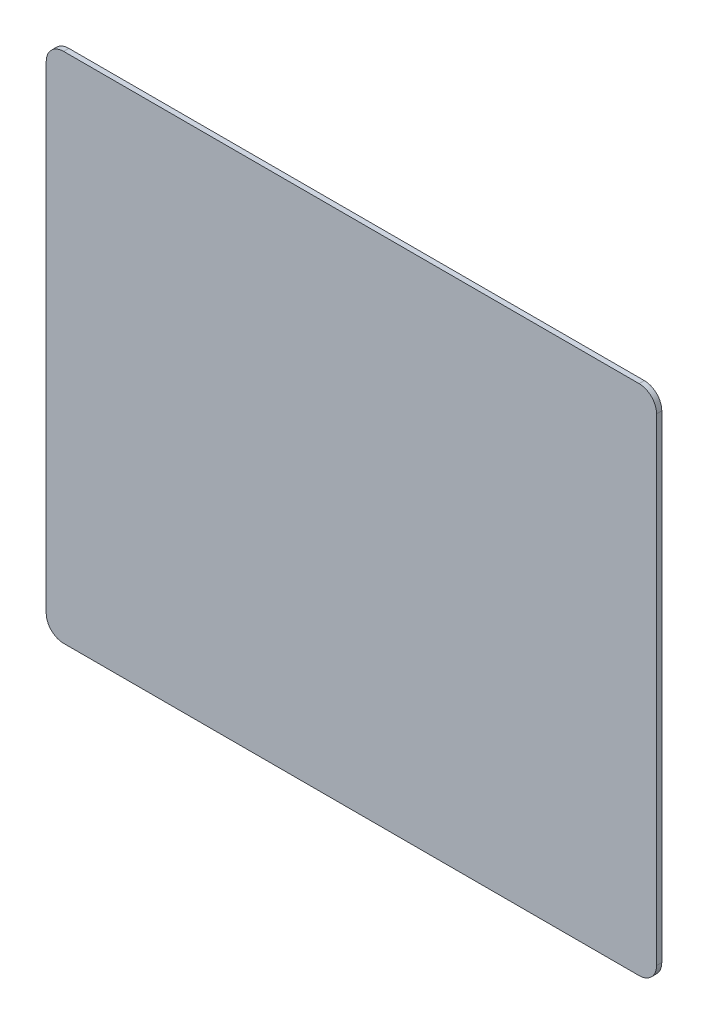
from build123d import *

# Parameters (mm, degrees)
SKETCH1_W           = 700
SKETCH1_H           = 588
BOSS_EXTRUDE1_DEPTH = 6
FILLET1_R           = 20


with BuildPart() as part:
    # Sketch1 → Boss-Extrude1 (new body)
    with BuildSketch(Plane.XY):
        Rectangle(SKETCH1_W, SKETCH1_H)
    extrude(amount=BOSS_EXTRUDE1_DEPTH)

    # Fillet1
    fillet1_edges = [part.edges().sort_by_distance(p)[0] for p in [
        (350, -294, 3),
        (-350, -294, 3),
        (-350, 294, 3),
        (350, 294, 3),
    ]]
    fillet(fillet1_edges, radius=FILLET1_R)


solid = part.part
